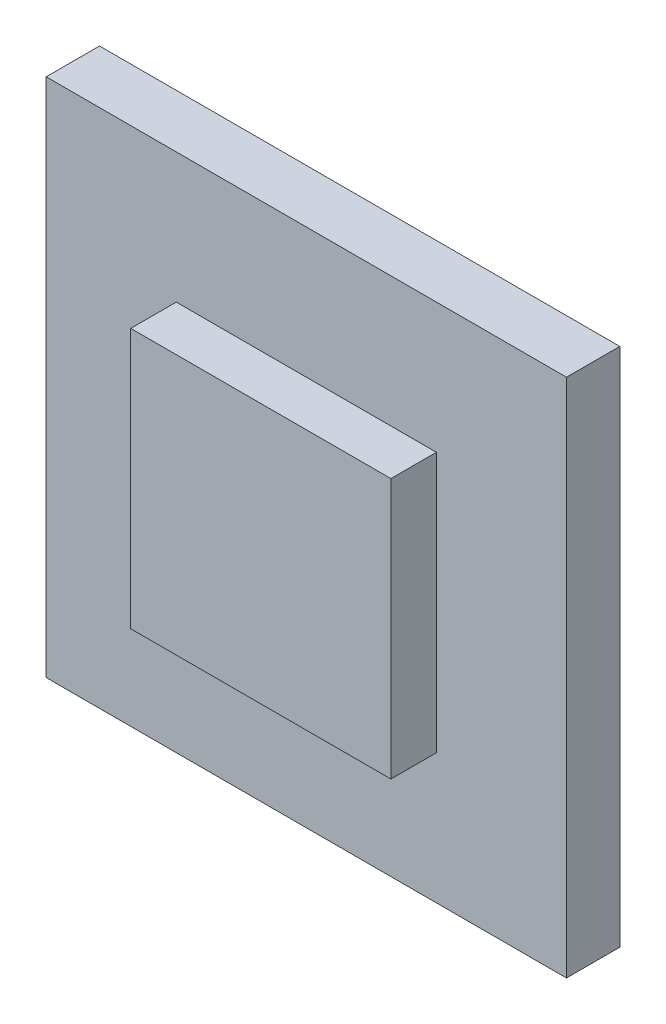
from build123d import *

# Parameters (mm, degrees)
SKETCH_1_W      = 4
SKETCH_1_H      = 4
EXTRUDE_1_DEPTH = 0.41
SKETCH_2_W      = 2
SKETCH_2_H      = 2
EXTRUDE_2_DEPTH = 0.35


with BuildPart() as part:
    # 草图1 → 凸台-拉伸1 (new body)
    with BuildSketch(Plane.XY):
        Rectangle(SKETCH_1_W, SKETCH_1_H)
    extrude(amount=EXTRUDE_1_DEPTH)

    # 草图2 → 凸台-拉伸2 (add)
    with BuildSketch(Plane.XY.offset(0.41)):
        Rectangle(SKETCH_2_W, SKETCH_2_H)
    extrude(amount=EXTRUDE_2_DEPTH)


solid = part.part
